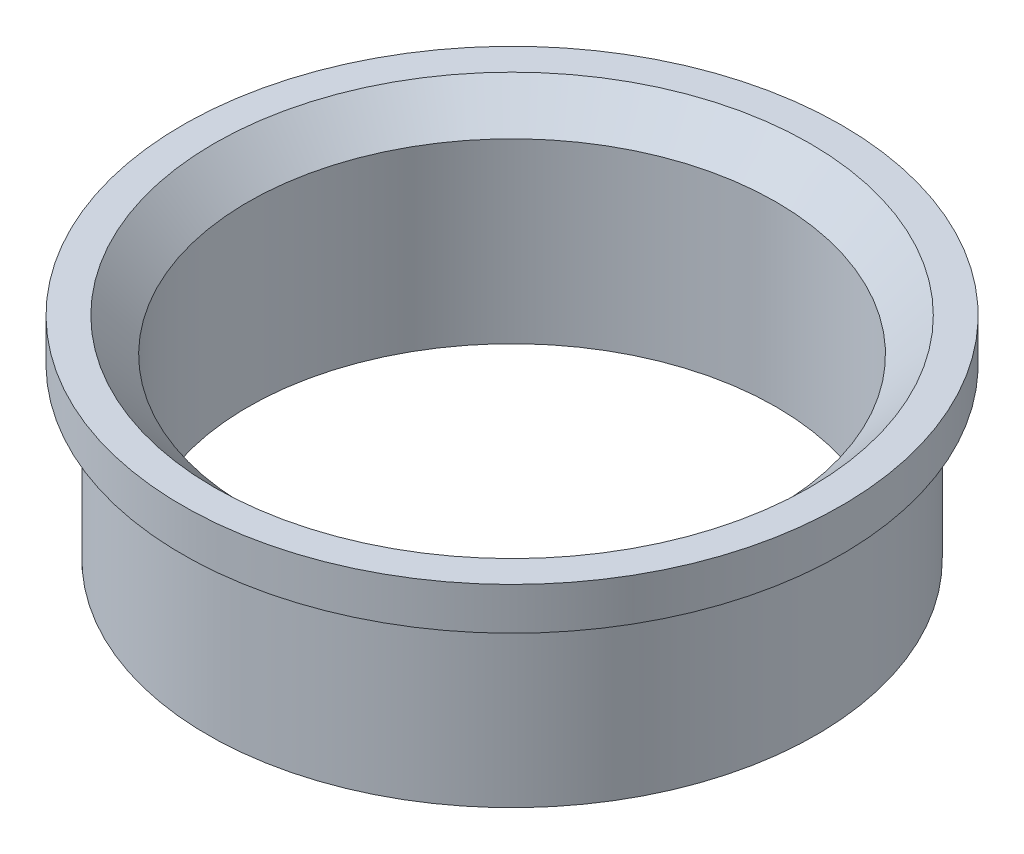
from build123d import *


with BuildPart() as part:
    # Sketch2 → Revolve1 (revolve)
    with BuildSketch(Plane.XY, mode=Mode.PRIVATE) as revolve1_sk:
        Polygon((72, 0), (72, 40), (78, 40), (78, 50), (70.5, 50), (62.5, 42), (62.5, 0), align=None)
    revolve(revolve1_sk.sketch.rotate(Axis((0, 0, 0), (0, 1, 0)), 90), axis=Axis((0, 0, 0), (0, 1, 0)))


solid = part.part
